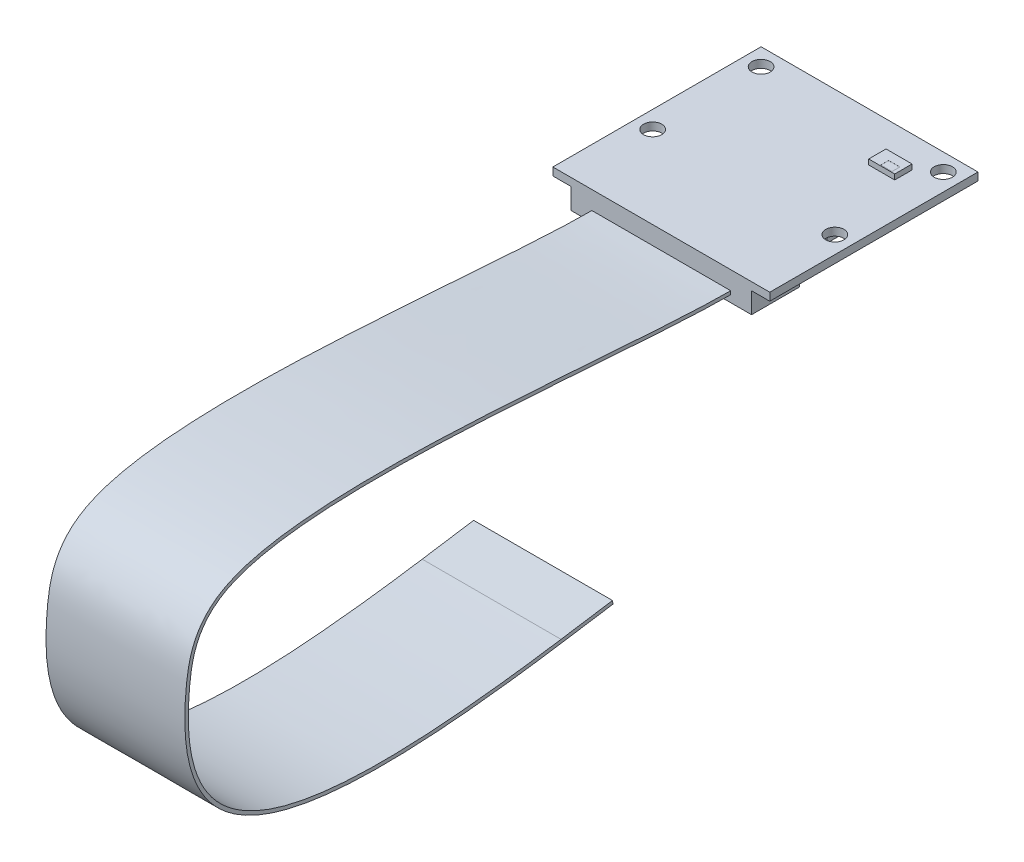
from build123d import *

# Parameters (mm, degrees)
SKIZZE1_W                                 = 25
SKIZZE1_H                                 = 24
PCB_DEPTH                                 = 0.9
SKIZZE2_R                                 = 1.05
MOUNTING_HOLES_DEPTH                      = 20.165333287
SKIZZE3_W                                 = 20.8
SKIZZE3_H                                 = 5.5
CONNECTOR_CLOSED_DEPTH                    = 2.4
SKIZZE4_W                                 = 17.7
SKIZZE4_H                                 = 11.6
COMPONENTS_WORST_CASE_BOUNDARY_BOX_DEPTH  = 1.3
SKIZZE6_W                                 = 16
SKIZZE6_H                                 = 0.4
SKIZZE7_W                                 = 3
SKIZZE7_H                                 = 2
COMPONENTS_WORST_CASE_BOUNDARY_BOX2_DEPTH = 0.6
SKIZZE8_W                                 = 1.3
SKIZZE8_H                                 = 0.9
STATUS_LED_DEPTH                          = 0.01


with BuildPart() as part:
    # Skizze1 → PCB (new body)
    with BuildSketch(Plane(origin=(0, 0, 0), x_dir=(1, 0, 0), z_dir=(0, 1, 0))):
        with Locations((0, 2.5)):
            Rectangle(SKIZZE1_W, SKIZZE1_H)
    extrude(amount=-PCB_DEPTH)

    # Skizze2 → Mounting_Holes (cut, through all)
    with BuildSketch(Plane(origin=(0, 0, 0), x_dir=(1, 0, 0), z_dir=(0, 1, 0))):
        with Locations(Location((10.5, 12.5, 0), (0, 0, 270))):
            Circle(SKIZZE2_R)
        with Locations(Location((10.5, 0, 0), (0, 0, 270))):
            Circle(SKIZZE2_R)
        with Locations(Location((-10.5, 0, 0), (0, 0, 90))):
            Circle(SKIZZE2_R)
        with Locations(Location((-10.5, 12.5, 0), (0, 0, 90))):
            Circle(SKIZZE2_R)
    extrude(amount=-MOUNTING_HOLES_DEPTH, mode=Mode.SUBTRACT)

    # Skizze3 → Connector_closed (add)
    with BuildSketch(Plane.XZ.offset(0.9)):
        with Locations((0, 6.75)):
            Rectangle(SKIZZE3_W, SKIZZE3_H)
    extrude(amount=CONNECTOR_CLOSED_DEPTH)

    # Skizze4 → Components_worst-case_Boundary-Box (add)
    with BuildSketch(Plane.XZ.offset(0.9)):
        with Locations((-0.15, -6.7)):
            Rectangle(SKIZZE4_W, SKIZZE4_H)
    extrude(amount=COMPONENTS_WORST_CASE_BOUNDARY_BOX_DEPTH)

    # Cable_156mm_free_Length: sweep along a path in Skizze5
    with BuildLine() as cable_156mm_free_length_path:  # in the path sketch's own coordinates; laid on its plane below (add() does not lay a ready-made edge on the line's plane)
        Line((-23.066624538, -26.602476402), (-28.996854723, -27.514819507))
        add(Edge.make_bspline(
            [(-28.996854723, -27.514819507), (-60.935134774, -32.428401054), (-76.09036837, -27.522538936), (-69.502616506, 4.568103405), (-22.978416705, -2.1), (-9.5, -2.1)],
            knots=[0, 0, 0, 0, 0.621882154, 0.721882154, 1, 1, 1, 1], degree=3))
    # Skizze6 → Cable_156mm_free_Length (sweep)
    with BuildSketch(Plane.XY.offset(9.5)):
        with Locations((0, -2.3)):
            Rectangle(SKIZZE6_W, SKIZZE6_H)
    sweep(path=Plane(origin=(0, 0, 0), x_dir=(0, 0, -1), z_dir=(1, 0, 0)) * cable_156mm_free_length_path.line)

    # Skizze7 → Components_worst-case_Boundary-Box2 (add)
    with BuildSketch(Plane(origin=(0, 0, 0), x_dir=(1, 0, 0), z_dir=(0, 1, 0))):
        with Locations((7, 9.9)):
            Rectangle(SKIZZE7_W, SKIZZE7_H)
    extrude(amount=COMPONENTS_WORST_CASE_BOUNDARY_BOX2_DEPTH)

    # Skizze8 → Status_LED (cut)
    with BuildSketch(Plane(origin=(0, 0.6, 0), x_dir=(1, 0, 0), z_dir=(0, 1, 0))):
        with Locations((7.45, 9.45)):
            Rectangle(SKIZZE8_W, SKIZZE8_H)
    extrude(amount=-STATUS_LED_DEPTH, mode=Mode.SUBTRACT)


solid = part.part
